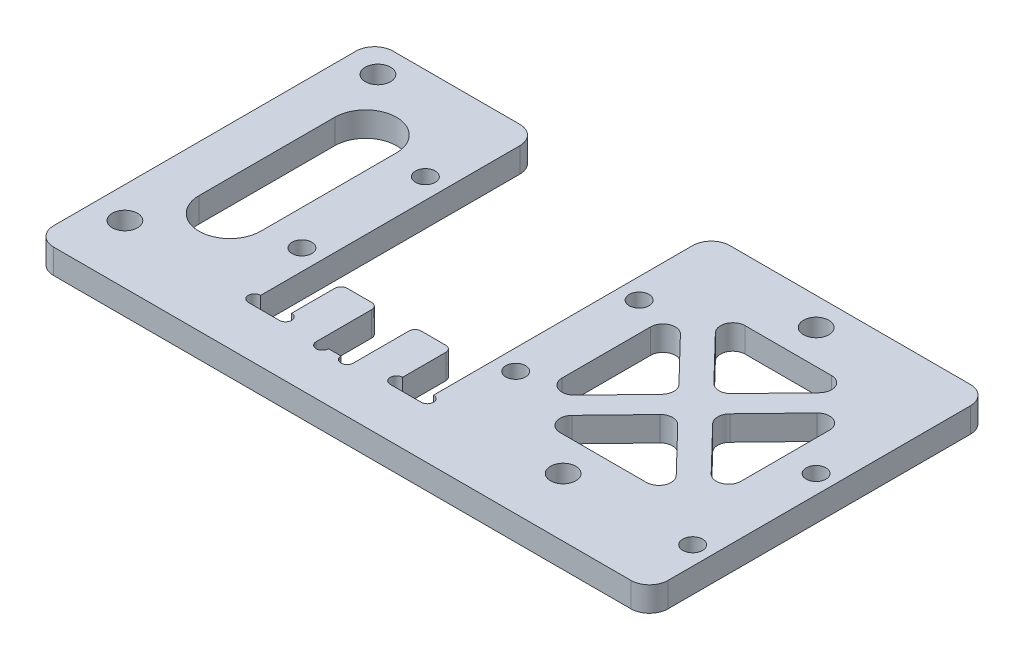
from build123d import *

# Parameters (mm, degrees)
EXTRUDE_1_DEPTH     = 4
SKETCH_2_W          = 5.98
SKETCH_2_H          = 10
EXTRUDE_2_DEPTH     = 4
SKETCH_4_R          = 1
SKETCH_4_W          = 55
SKETCH_4_H          = 8
CUT_EXTRUDE_1_DEPTH = 4
SKETCH_5_R          = 1.6
CUT_EXTRUDE_2_DEPTH = 4
SKETCH_6_W          = 31.5
SKETCH_6_H          = 52
EXTRUDE_3_DEPTH     = 4
SKETCH_7_R          = 1.6
CUT_EXTRUDE_3_DEPTH = 4
SKETCH_8_W          = 13.057041555
SKETCH_8_H          = 52
SKETCH_8_W_2        = 44.99
SKETCH_8_H_2        = 3
EXTRUDE_4_DEPTH     = 4
SKETCH_10_R         = 2.05
CUT_EXTRUDE_4_DEPTH = 10
FILLET_1_R          = 1
FILLET_2_R          = 3
SKETCH_11_W         = 28.99
SKETCH_11_H         = 30
CUT_EXTRUDE_5_DEPTH = 10
EXTRUDE_1_2_DEPTH   = 4
FILLET_3_R          = 2
SKETCH_13_R         = 1.6
EXTRUDE_5_DEPTH     = 4
SKETCH_15_R         = 1.6
CUT_EXTRUDE_6_DEPTH = 4


with BuildPart() as part:
    # 草图1 → Extrude 1 (new body)
    with BuildSketch(Plane(origin=(0, 0, 0), x_dir=(1, 0, 0), z_dir=(0, 1, 0))):
        Polygon((-14.01, 30), (-27.5, 30), (-27.5, -30), (27.5, -30), (27.5, 30), (14.01, 30), (14.01, 22), (14.01, -22), (-14.01, -22), (-14.01, 22), align=None)
    extrude(amount=EXTRUDE_1_DEPTH)

    # 草图2 → 凸台-拉伸2 (add)
    with BuildSketch(Plane(origin=(0, 4, 0), x_dir=(1, 0, 0), z_dir=(0, 1, 0))):
        with Locations((-6, -17)):
            Rectangle(SKETCH_2_W, SKETCH_2_H)
        with Locations((6, -17)):
            Rectangle(SKETCH_2_W, SKETCH_2_H)
    extrude(amount=-EXTRUDE_2_DEPTH)

    # 草图4 → 切除-拉伸1 (cut)
    with BuildSketch(Plane.XZ):
        with Locations((8.99, 21)):
            Circle(SKETCH_4_R)
        with Locations((14.01, 21)):
            Circle(SKETCH_4_R)
        with Locations((-2.01, 22)):
            Circle(SKETCH_4_R)
        with Locations((2.01, 22)):
            Circle(SKETCH_4_R)
        with Locations((-14.01, 21)):
            Circle(SKETCH_4_R)
        with Locations((-8.99, 21)):
            Circle(SKETCH_4_R)
        with Locations((0, -26)):
            Rectangle(SKETCH_4_W, SKETCH_4_H)
    extrude(amount=-CUT_EXTRUDE_1_DEPTH, mode=Mode.SUBTRACT)

    # 草图5 → 切除-拉伸2 (cut)
    with BuildSketch(Plane.XZ):
        with Locations(Location((17.01, 10, 0), (0, 0, 270))):
            Circle(SKETCH_5_R)
        with Locations(Location((17.01, -10, 0), (0, 0, 270))):
            Circle(SKETCH_5_R)
        with Locations(Location((-17.01, -10, 0), (0, 0, 270))):
            Circle(SKETCH_5_R)
        with Locations(Location((-17.01, 10, 0), (0, 0, 270))):
            Circle(SKETCH_5_R)
    extrude(amount=-CUT_EXTRUDE_2_DEPTH, mode=Mode.SUBTRACT)

    # 草图6 → 凸台-拉伸3 (add)
    with BuildSketch(Plane.XZ):
        with Locations((43.25, 4)):
            Rectangle(SKETCH_6_W, SKETCH_6_H)
    extrude(amount=-EXTRUDE_3_DEPTH)

    # 草图7 → 切除-拉伸3 (cut)
    with BuildSketch(Plane.XZ):
        with Locations(Location((56, 20, 0), (0, 0, 270))):
            Circle(SKETCH_7_R)
        with Locations(Location((56, 0, 0), (0, 0, 270))):
            Circle(SKETCH_7_R)
    extrude(amount=-CUT_EXTRUDE_3_DEPTH, mode=Mode.SUBTRACT)

    # 草图8 → 凸台-拉伸4 (add)
    with BuildSketch(Plane.XZ):
        with Locations((-34.028520778, 4)):
            Rectangle(SKETCH_8_W, SKETCH_8_H)
        Polygon((-14.01, -25), (-14.01, -22), (-27.5, -22), (-40.557041555, -22), (-40.557041555, -25), align=None)
        with Locations((36.505, -23.5)):
            Rectangle(SKETCH_8_W_2, SKETCH_8_H_2)
    extrude(amount=-EXTRUDE_4_DEPTH)

    # 草图10 → 切除-拉伸4 (cut)
    with BuildSketch(Plane.XZ):
        with Locations(Location((-35.507041555, -20.5, 0), (0, 0, 270))):
            Circle(SKETCH_10_R)
        with Locations(Location((-35.507041555, 20.5, 0), (0, 0, 270))):
            Circle(SKETCH_10_R)
        with Locations(Location((35.507041555, 20.5, 0), (0, 0, 270))):
            Circle(SKETCH_10_R)
        with Locations(Location((35.507041555, -20.5, 0), (0, 0, 270))):
            Circle(SKETCH_10_R)
    extrude(amount=-CUT_EXTRUDE_4_DEPTH, mode=Mode.SUBTRACT)

    # 圆角1
    fillet_1_edges = [part.edges().sort_by_distance(p)[0] for p in [
        (-8.99, 2, 12),
        (-3.01, 2, 12),
        (3.01, 2, 12),
        (8.99, 2, 12),
    ]]
    fillet(fillet_1_edges, radius=FILLET_1_R)

    # 圆角2
    fillet_2_edges = [part.edges().sort_by_distance(p)[0] for p in [
        (59, 2, 30),
        (-40.557041555, 2, -25),
        (-14.01, 2, -25),
        (-40.557041555, 2, 30),
        (14.01, 2, -25),
        (59, 2, -25),
    ]]
    fillet(fillet_2_edges, radius=FILLET_2_R)

    # 草图11 → 切除-拉伸5 (cut)
    with BuildSketch(Plane(origin=(0, 4, 0), x_dir=(1, 0, 0), z_dir=(0, 1, 0))):
        with Locations((36.505, 0)):
            Rectangle(SKETCH_11_W, SKETCH_11_H)
        with BuildLine():
            Line((-23, 11), (-23, -11))
            ThreePointArc((-23, -11), (-28, -16), (-33, -11))
            Line((-33, -11), (-33, 11))
            ThreePointArc((-33, 11), (-28, 16), (-23, 11))
        make_face()
    extrude(amount=-CUT_EXTRUDE_5_DEPTH, mode=Mode.SUBTRACT)

    # 草图12 → Extrude 1 2 (add)
    with BuildSketch(Plane(origin=(0, 4, 0), x_dir=(1, 0, 0), z_dir=(0, 1, 0))):
        Polygon((20.571783704, 13.610203653), (49.561783704, -16.389796347), (52.438216296, -13.610203653), (23.448216296, 16.389796347), align=None)
        Polygon((23.448216296, -16.389796347), (52.438216296, 13.610203653), (49.561783704, 16.389796347), (20.571783704, -13.610203653), align=None)
    extrude(amount=-EXTRUDE_1_2_DEPTH)

    # 圆角3
    fillet_3_edges = [part.edges().sort_by_distance(p)[0] for p in [
        (24.791222833, 2, 15),
        (48.218777167, 2, 15),
        (51, 2, -12.121880477),
        (51, 2, 12.121880477),
        (48.218777167, 2, -15),
        (24.791222833, 2, -15),
        (22.01, 2, 12.121880477),
        (22.01, 2, -12.121880477),
        (33.723777167, 2, 0),
        (36.505, 2, -2.878119523),
        (39.286222833, 2, 0),
        (36.505, 2, 2.878119523),
    ]]
    fillet(fillet_3_edges, radius=FILLET_3_R)

    # 草图13 → 凸台-拉伸5 (add)
    with BuildSketch(Plane.XZ):
        with Locations((17.01, -10)):
            Circle(SKETCH_13_R)
        with Locations((17.01, 10)):
            Circle(SKETCH_13_R)
        with Locations((-17.01, -10)):
            Circle(SKETCH_13_R)
        with Locations((-17.01, 10)):
            Circle(SKETCH_13_R)
    extrude(amount=-EXTRUDE_5_DEPTH)

    # 草图15 → 切除-拉伸6 (cut)
    with BuildSketch(Plane.XZ):
        with Locations(Location((-17.320508076, -10, 0), (0, 0, 270))):
            Circle(SKETCH_15_R)
        with Locations(Location((-17.320508076, 10, 0), (0, 0, 270))):
            Circle(SKETCH_15_R)
        with Locations(Location((17.320508076, 10, 0), (0, 0, 270))):
            Circle(SKETCH_15_R)
        with Locations(Location((17.320508076, -10, 0), (0, 0, 270))):
            Circle(SKETCH_15_R)
    extrude(amount=-CUT_EXTRUDE_6_DEPTH, mode=Mode.SUBTRACT)


solid = part.part
